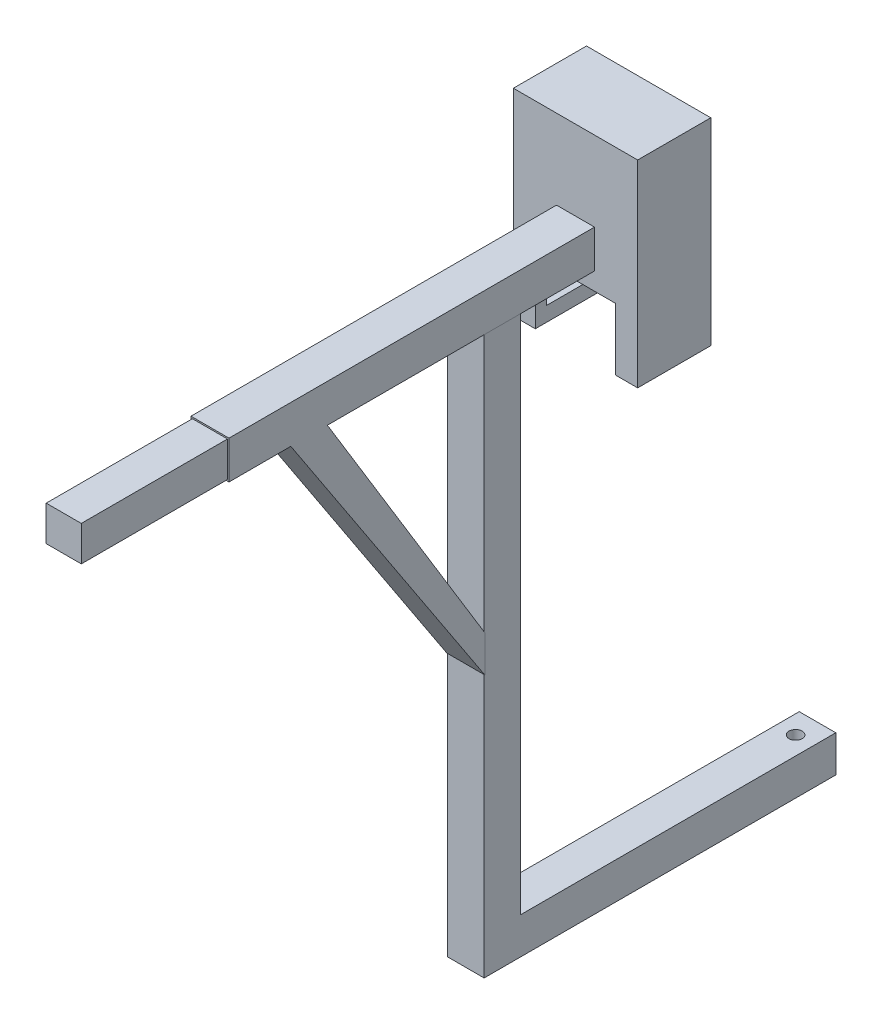
from build123d import *

# Parameters (mm, degrees)
SKETCH1_W           = 4.8
SKETCH1_H           = 4.8
BOSS_EXTRUDE1_DEPTH = 20
SKETCH2_W           = 5.2
SKETCH2_H           = 5.2
BOSS_EXTRUDE2_DEPTH = 50
SKETCH3_W           = 17
SKETCH3_H           = 27
BOSS_EXTRUDE3_DEPTH = 10
SKETCH4_W           = 13
SKETCH4_H           = 23
CUT_EXTRUDE1_DEPTH  = 8.5
SKETCH5_W           = 11
SKETCH5_H           = 8.5
CUT_EXTRUDE2_DEPTH  = 8.5
SKETCH6_W           = 5
SKETCH6_H           = 5
BOSS_EXTRUDE4_DEPTH = 81.5
SKETCH7_W           = 5
SKETCH7_H           = 5
BOSS_EXTRUDE5_DEPTH = 43.1
SKETCH9_R           = 0.9
CUT_EXTRUDE4_DEPTH  = 125.748466924
BOSS_EXTRUDE6_DEPTH = 5.2


with BuildPart() as part:
    # Sketch1 → Boss-Extrude1 (new body)
    with BuildSketch(Plane.XY):
        with Locations((2.4, -2.4)):
            Rectangle(SKETCH1_W, SKETCH1_H)
    extrude(amount=BOSS_EXTRUDE1_DEPTH)

    # Sketch2 → Boss-Extrude2 (add)
    with BuildSketch(Plane(origin=(0, 0, 0), x_dir=(-1, 0, 0), z_dir=(0, 0, -1))):
        with Locations((-2.4, -2.4)):
            Rectangle(SKETCH2_W, SKETCH2_H)
    extrude(amount=BOSS_EXTRUDE2_DEPTH)

    # Sketch3 → Boss-Extrude3 (add)
    with BuildSketch(Plane(origin=(0, 0, -50), x_dir=(-1, 0, 0), z_dir=(0, 0, -1))):
        with Locations((-2.4, -2.4)):
            Rectangle(SKETCH3_W, SKETCH3_H)
    extrude(amount=BOSS_EXTRUDE3_DEPTH)

    # Sketch4 → Cut-Extrude1 (cut)
    with BuildSketch(Plane(origin=(0, 0, -60), x_dir=(-1, 0, 0), z_dir=(0, 0, -1))):
        with Locations((-2.4, -2.4)):
            Rectangle(SKETCH4_W, SKETCH4_H)
    extrude(amount=-CUT_EXTRUDE1_DEPTH, mode=Mode.SUBTRACT)

    # Sketch5 → Cut-Extrude2 (cut)
    with BuildSketch(Plane.XZ.offset(15.9)):
        with Locations((2.4, -54.25)):
            Rectangle(SKETCH5_W, SKETCH5_H)
    extrude(amount=-CUT_EXTRUDE2_DEPTH, mode=Mode.SUBTRACT)

    # Sketch6 → Boss-Extrude4 (add)
    with BuildSketch(Plane(origin=(0, 0.2, 0), x_dir=(1, 0, 0), z_dir=(0, 1, 0))):
        with Locations((2.4, 37.5)):
            Rectangle(SKETCH6_W, SKETCH6_H)
    extrude(amount=-BOSS_EXTRUDE4_DEPTH)

    # Sketch7 → Boss-Extrude5 (add)
    with BuildSketch(Plane(origin=(0, 0, -40), x_dir=(-1, 0, 0), z_dir=(0, 0, -1))):
        with Locations((-2.4, -78.8)):
            Rectangle(SKETCH7_W, SKETCH7_H)
    extrude(amount=BOSS_EXTRUDE5_DEPTH)

    # Sketch9 → Cut-Extrude4 (cut, through all)
    with BuildSketch(Plane.XZ.offset(81.3)):
        with Locations((2.4, -80.1)):
            Circle(SKETCH9_R)
    extrude(amount=-CUT_EXTRUDE4_DEPTH, mode=Mode.SUBTRACT)

    # Sketch12 → Boss-Extrude6 (add)
    with BuildSketch(Plane(origin=(5, 0, 0), x_dir=(0, 0, -1), z_dir=(1, 0, 0))):
        Polygon((13.455782968, -5), (35, -40.359932103), (35, -45.359932103), (8.455782968, -5), align=None)
    extrude(amount=-BOSS_EXTRUDE6_DEPTH)


solid = part.part
